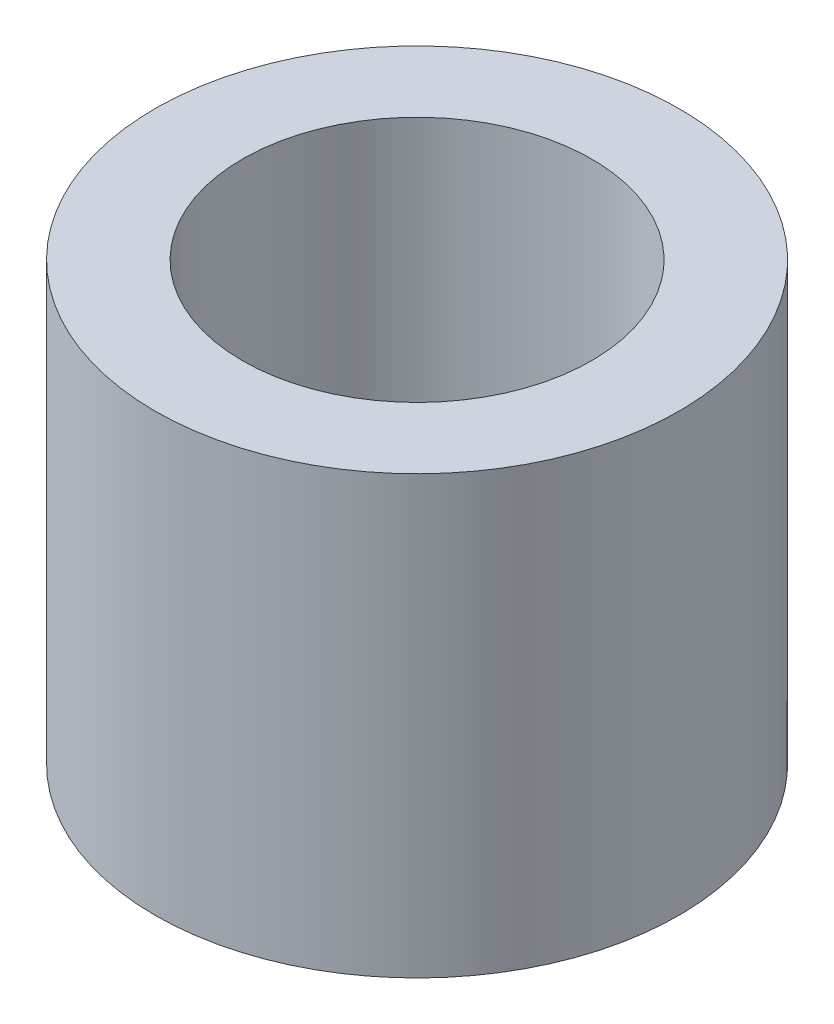
from build123d import *

# Parameters (mm, degrees)
SKETCH1_R           = 6
SKETCH1_R_2         = 4
BOSS_EXTRUDE1_DEPTH = 10


with BuildPart() as part:
    # Sketch1 → Boss-Extrude1 (new body)
    with BuildSketch(Plane(origin=(0, 0, 0), x_dir=(1, 0, 0), z_dir=(0, 1, 0))):
        with Locations(Location((0, 0, 0), (0, 0, 270))):
            Circle(SKETCH1_R)
        with Locations(Location((0, 0, 0), (0, 0, 270))):
            Circle(SKETCH1_R_2, mode=Mode.SUBTRACT)
    extrude(amount=BOSS_EXTRUDE1_DEPTH)


solid = part.part
